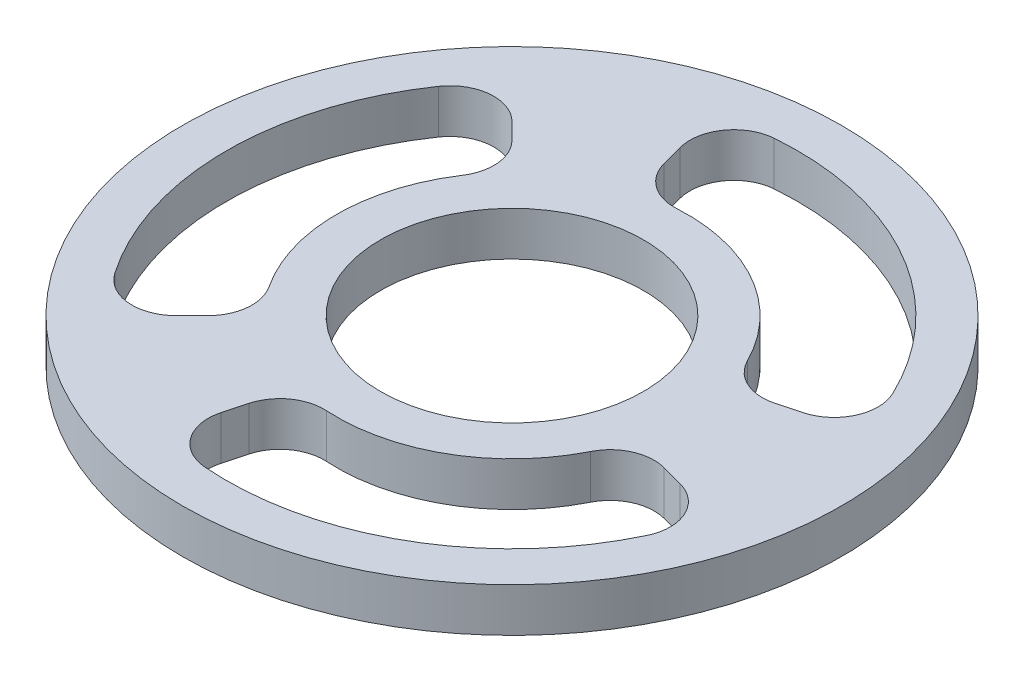
from build123d import *

# Parameters (mm, degrees)
SKETCH2_R                = 47.625
SKETCH2_R_2              = 19
BOSS_EXTRUDE1_DEPTH      = 6.35
CUT_EXTRUDE1_DEPTH       = 68.650600515
FILLET1_R                = 6.35
CIRPATTERN1_COUNT        = 3
FILLET1_OF_CIRPATTERN1_R = 6.35


with BuildPart() as part:
    # Sketch2 → Boss-Extrude1 (new body)
    with BuildSketch(Plane(origin=(0, 0, 0), x_dir=(1, 0, 0), z_dir=(0, 1, 0))):
        with Locations(Location((0, 0, 0), (0, 0, 270))):
            Circle(SKETCH2_R)
        with Locations(Location((0, 0, 0), (0, 0, 270))):
            Circle(SKETCH2_R_2, mode=Mode.SUBTRACT)
    extrude(amount=BOSS_EXTRUDE1_DEPTH)

    # Sketch3 → Cut-Extrude1 (cut, through all)
    with BuildSketch(Plane(origin=(0, 6.35, 0), x_dir=(1, 0, 0), z_dir=(0, 1, 0))):
        with BuildLine():
            Line((24.486219696, 6.561062793), (39.86858848, 10.682756087))
            ThreePointArc((39.86858848, 10.682756087), (20.6375, 35.745198541), (-10.682756087, 39.86858848))
            Line((-10.682756087, 39.86858848), (-6.561062793, 24.486219696))
            ThreePointArc((-6.561062793, 24.486219696), (12.675, 21.953743986), (24.486219696, 6.561062793))
        make_face()
    cut_extrude1 = extrude(amount=-CUT_EXTRUDE1_DEPTH, mode=Mode.SUBTRACT)

    # Fillet1
    fillet1_edges = [part.edges().sort_by_distance(p)[0] for p in [
        (24.486219696, 3.175, -6.561062793),
        (-6.561062793, 3.175, -24.486219696),
        (-10.682756087, 3.175, -39.86858848),
        (39.86858848, 3.175, -10.682756087),
    ]]
    fillet(fillet1_edges, radius=FILLET1_R)

    # CirPattern1: Cut-Extrude1 ×3 about axis
    cirpattern1_axis = Axis((0, 0, 0), (0, 1, 0))
    for i in range(1, CIRPATTERN1_COUNT):
        add(cut_extrude1.rotate(cirpattern1_axis, i * 360 / CIRPATTERN1_COUNT), mode=Mode.SUBTRACT)

    # Fillet1 of CirPattern1
    fillet1_of_cirpattern1_edges = [part.edges().sort_by_distance(p)[0] for p in [
        (-17.925156903, 3.175, -17.925156903),
        (-17.925156903, 3.175, 17.925156903),
        (-29.185832393, 3.175, 29.185832393),
        (-29.185832393, 3.175, -29.185832393),
        (-6.561062793, 3.175, 24.486219696),
        (24.486219696, 3.175, 6.561062793),
        (39.86858848, 3.175, 10.682756087),
        (-10.682756087, 3.175, 39.86858848),
    ]]
    fillet(fillet1_of_cirpattern1_edges, radius=FILLET1_OF_CIRPATTERN1_R)


solid = part.part
